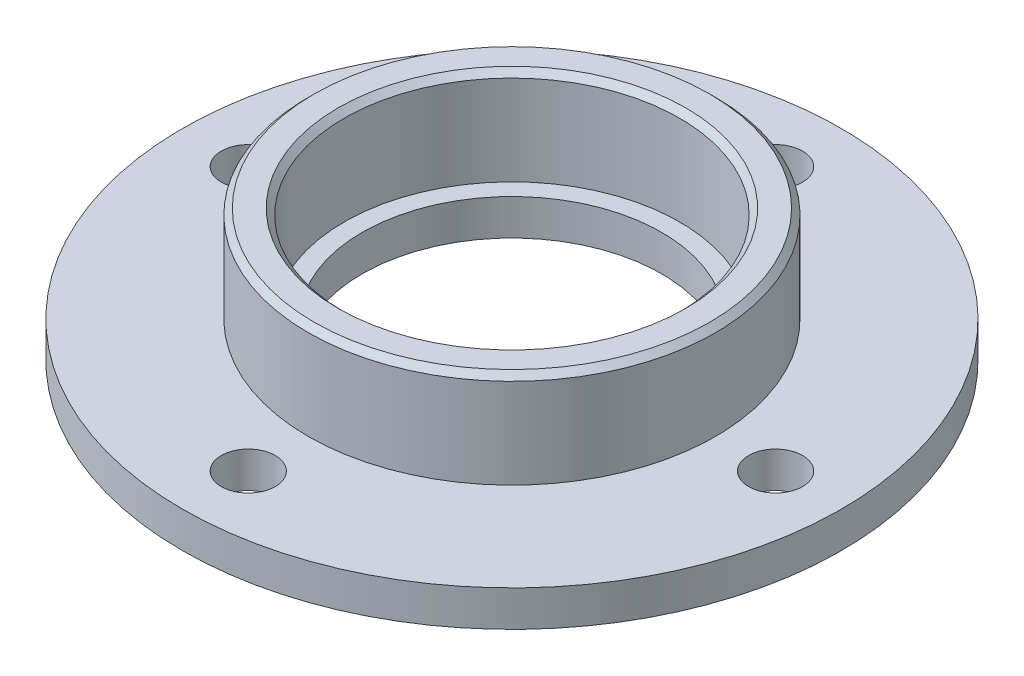
from build123d import *

# Parameters (mm, degrees)
SKETCH1_R                = 27.5
SKETCH1_R_2              = 12.5
SKETCH1_R_3              = 1
BOSS_EXTRUDE1_DEPTH      = 1.5
SKETCH2_R                = 17
SKETCH2_R_2              = 14
BOSS_EXTRUDE2_DEPTH      = 8
CHAMFER1_SIZE            = 0.5
M4_CLEARANCE_HOLE1_D     = 4.5
M4_CLEARANCE_HOLE1_DEPTH = 11.5
M4_CLEARANCE_HOLE1_TIP   = 1.351936393


with BuildPart() as part:
    # Sketch1 → Boss-Extrude1 (new, symmetric)
    with BuildSketch(Plane(origin=(0, 0, 0), x_dir=(1, 0, 0), z_dir=(0, 1, 0))):
        with Locations(Location((0, 0, 0), (0, 0, 270))):
            Circle(SKETCH1_R)
        with Locations(Location((0, 0, 0), (0, 0, 270))):
            Circle(SKETCH1_R_2, mode=Mode.SUBTRACT)
        with Locations(Location((0, 22, 0), (0, 0, 270))):
            Circle(SKETCH1_R_3, mode=Mode.SUBTRACT)
        with Locations(Location((22, 0, 0), (0, 0, 270))):
            Circle(SKETCH1_R_3, mode=Mode.SUBTRACT)
        with Locations(Location((0, -22, 0), (0, 0, 270))):
            Circle(SKETCH1_R_3, mode=Mode.SUBTRACT)
        with Locations(Location((-22, 0, 0), (0, 0, 270))):
            Circle(SKETCH1_R_3, mode=Mode.SUBTRACT)
    extrude(amount=BOSS_EXTRUDE1_DEPTH, both=True)

    # Sketch2 → Boss-Extrude2 (add)
    with BuildSketch(Plane(origin=(0, 1.5, 0), x_dir=(1, 0, 0), z_dir=(0, 1, 0))):
        with Locations(Location((0, 0, 0), (0, 0, 270))):
            Circle(SKETCH2_R)
        with Locations(Location((0, 0, 0), (0, 0, 270))):
            Circle(SKETCH2_R_2, mode=Mode.SUBTRACT)
    extrude(amount=BOSS_EXTRUDE2_DEPTH)

    # Chamfer1
    chamfer1_edges = [part.edges().sort_by_distance(p)[0] for p in [
        (0, 9.5, -17),
        (0, 9.5, -14),
    ]]
    chamfer(chamfer1_edges, length=CHAMFER1_SIZE)

    # M4 Clearance Hole1
    with Locations(Plane(origin=(0, 1.5, 0), x_dir=(1, 0, 0), z_dir=(0, 1, 0))):
        with Locations((0, 22), (22, 0), (-22, 0), (0, -22)):
            Hole(M4_CLEARANCE_HOLE1_D / 2, depth=M4_CLEARANCE_HOLE1_DEPTH)
            with Locations((0, 0, -(M4_CLEARANCE_HOLE1_DEPTH + M4_CLEARANCE_HOLE1_TIP / 2))):  # 118° drill point
                Cone(0, M4_CLEARANCE_HOLE1_D / 2, M4_CLEARANCE_HOLE1_TIP, mode=Mode.SUBTRACT)


solid = part.part
